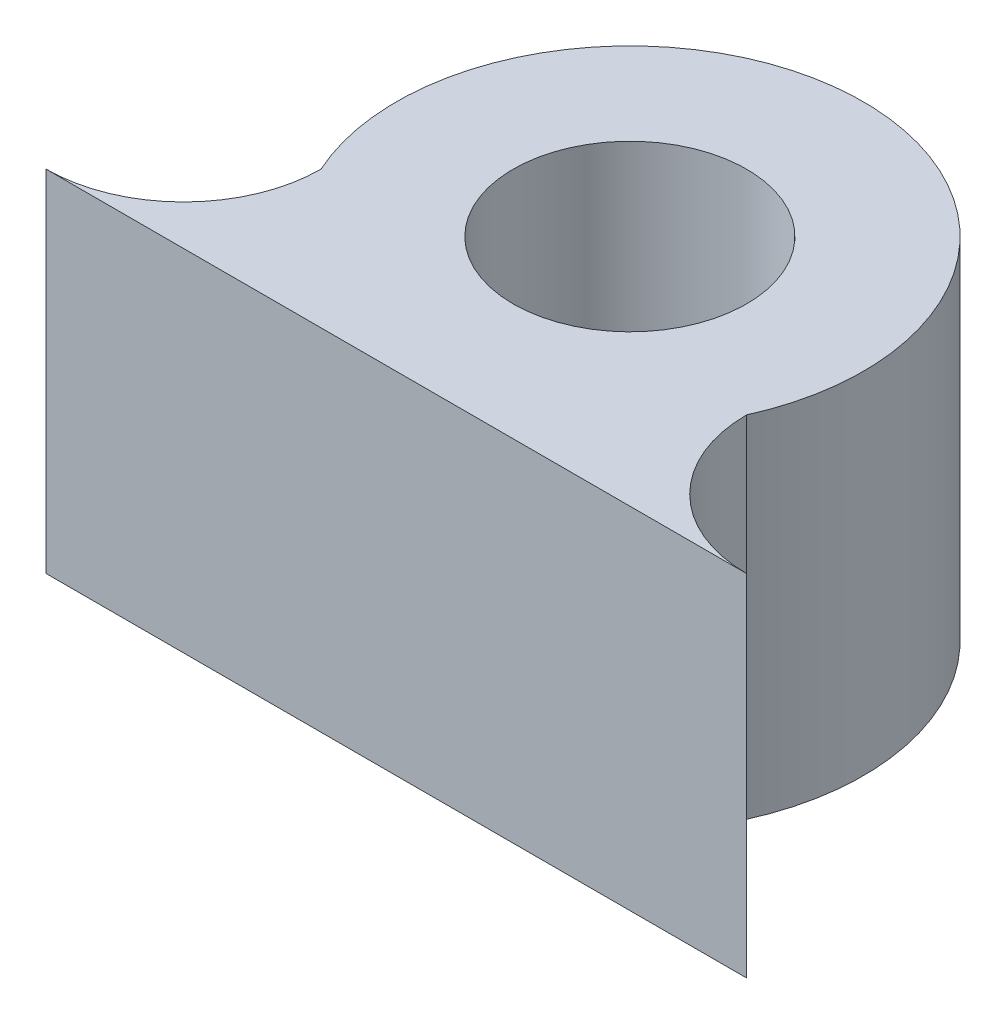
from build123d import *

# Parameters (mm, degrees)
SKETCH_1_R      = 2
SKETCH_1_R_2    = 1
EXTRUDE_1_DEPTH = 3
EXTRUDE_START   = -3
EXTRUDE_2_DEPTH = 3


with BuildPart() as part:
    # 草图1 → 凸台-拉伸1 (new body)
    with BuildSketch(Plane(origin=(0, 0, 0), x_dir=(1, 0, 0), z_dir=(0, 1, 0))):
        with Locations(Location((0, 0, 0), (0, 0, 270))):
            Circle(SKETCH_1_R)
        with Locations(Location((0, 0, 0), (0, 0, 270))):
            Circle(SKETCH_1_R_2, mode=Mode.SUBTRACT)
    extrude(amount=EXTRUDE_1_DEPTH)

    # 草图2 → 凸台-拉伸2 (add)
    with BuildSketch(Plane(origin=(0, 3, 0), x_dir=(1, 0, 0), z_dir=(0, 1, 0)).offset(EXTRUDE_START)):
        with BuildLine():
            Line((-3, -2), (0, -2))
            ThreePointArc((0, -2), (-1.084953614, -1.680141558), (-1.822875656, -0.822875656))
            ThreePointArc((-1.822875656, -0.822875656), (-2.167647394, -1.655228262), (-3, -2))
        make_face()
        with BuildLine():
            ThreePointArc((1.822875656, -0.822875656), (1.084953614, -1.680141558), (0, -2))
            Line((0, -2), (3, -2))
            ThreePointArc((3, -2), (2.167647394, -1.655228262), (1.822875656, -0.822875656))
        make_face()
    extrude(amount=EXTRUDE_2_DEPTH)


solid = part.part
